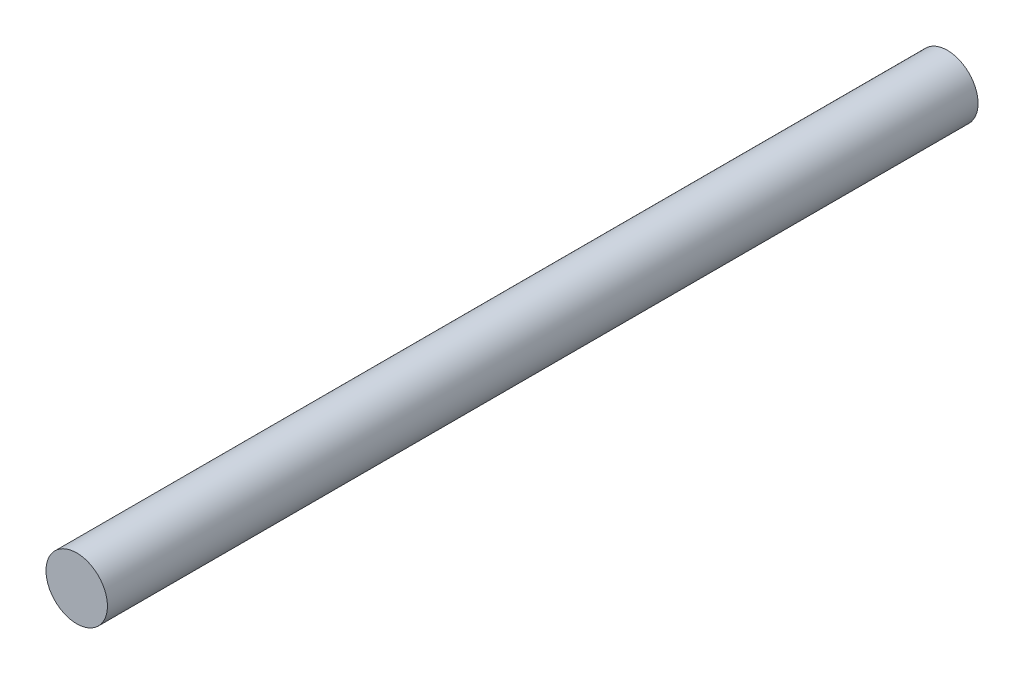
from build123d import *

# Parameters (mm, degrees)
SKETCH1_R           = 1.5875
BOSS_EXTRUDE1_DEPTH = 22.5


with BuildPart() as part:
    # Sketch1 → Boss-Extrude1 (new, symmetric)
    with BuildSketch(Plane.XY):
        with Locations(Location((0, 0, 0), (0, 0, 180))):
            Circle(SKETCH1_R)
    extrude(amount=BOSS_EXTRUDE1_DEPTH, both=True)


solid = part.part
